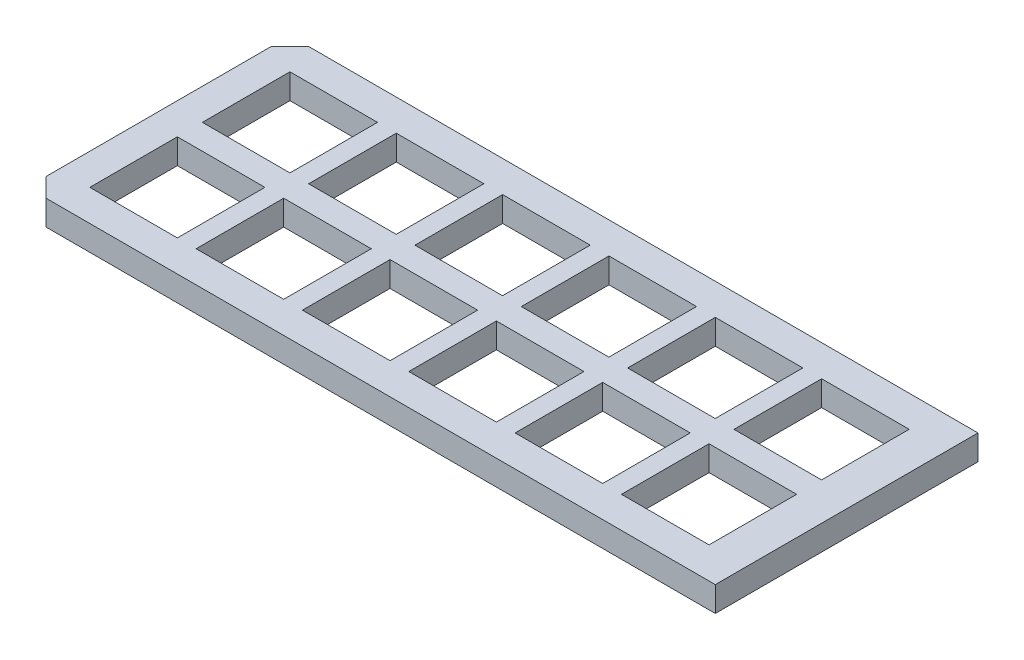
from build123d import *

# Parameters (mm, degrees)
EXTRUDE_1_DEPTH = 4


with BuildPart() as part:
    # Sketch 1 → Бобышка-Вытянуть1 (new body)
    with BuildSketch(Plane(origin=(-80.845718526, 0, 24.821686241), x_dir=(0.9308571955160213, 0, -0.36538319823994075), z_dir=(0, -1, 0))):
        Polygon((0, 0), (99.60171992, 39.096002212), (114.947814246, 0), (15.346094326, -39.096002212), (11.457373145, -37.39958022), (-1.696421992, -3.888721181), align=None)
        Polygon((15.380892726, -33.710949838), (28.412893463, -28.595585062), (23.297528688, -15.563584325), (10.265527951, -20.6789491), align=None, mode=Mode.SUBTRACT)
        Polygon((8.803995158, -16.955520318), (21.835995895, -11.840155543), (16.720631119, 1.191845194), (3.688630382, -3.923519581), align=None, mode=Mode.SUBTRACT)
        Polygon((19.513202706, 2.287994789), (24.628567481, -10.744005948), (37.660568219, -5.628641173), (32.545203443, 7.403359564), align=None, mode=Mode.SUBTRACT)
        Polygon((35.33777503, 8.499509159), (40.453139805, -4.532491578), (53.485140542, 0.582873197), (48.369775767, 13.614873934), align=None, mode=Mode.SUBTRACT)
        Polygon((51.162347354, 14.711023529), (64.194348091, 19.826388304), (69.309712866, 6.794387567), (56.277712129, 1.679022792), align=None, mode=Mode.SUBTRACT)
        Polygon((95.843492738, 32.249417045), (100.958857514, 19.217416307), (87.926856776, 14.102051532), (82.811492001, 27.134052269), align=None, mode=Mode.SUBTRACT)
        Polygon((66.986919677, 20.922537899), (80.018920415, 26.037902675), (85.13428519, 13.005901937), (72.102284453, 7.890537162), align=None, mode=Mode.SUBTRACT)
        Polygon((73.559385355, 4.17839915), (86.591386092, 9.293763925), (91.711182758, -3.749527582), (78.679182021, -8.864892357), align=None, mode=Mode.SUBTRACT)
        Polygon((89.383957678, 10.38991352), (94.503754345, -2.653377987), (107.535755082, 2.461986788), (102.415958416, 15.505278295), align=None, mode=Mode.SUBTRACT)
        Polygon((70.766813768, 3.082249555), (75.886610434, -9.961041952), (62.854609697, -15.076406727), (57.734813031, -2.03311522), align=None, mode=Mode.SUBTRACT)
        Polygon((54.942241444, -3.129264815), (60.062038111, -16.172556322), (47.030037373, -21.287921097), (41.910240707, -8.24462959), align=None, mode=Mode.SUBTRACT)
        Polygon((39.117669121, -9.340779185), (44.237465787, -22.384070692), (31.20546505, -27.499435468), (26.085668383, -14.456143961), align=None, mode=Mode.SUBTRACT)
    extrude(amount=-EXTRUDE_1_DEPTH)


solid = part.part
